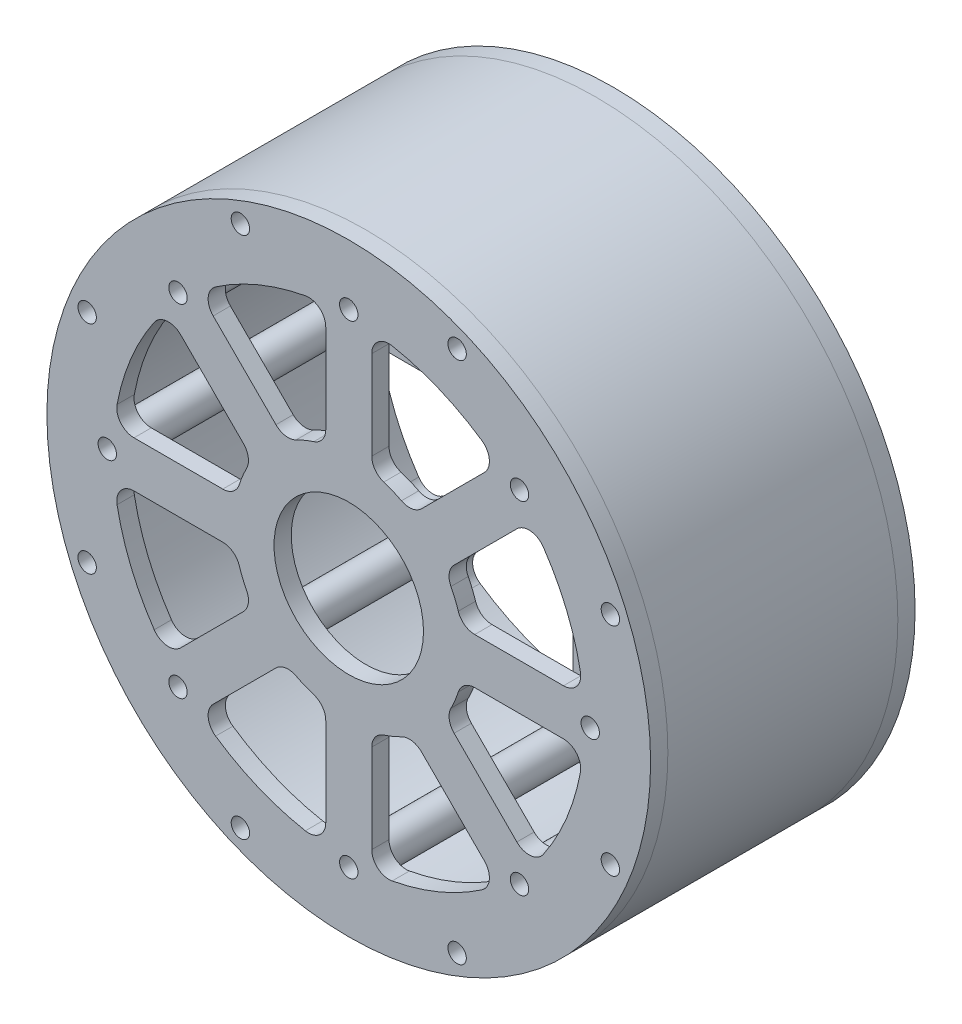
from build123d import *

# Parameters (mm, degrees)
SKETCH_1_R          = 52.5
SKETCH_1_R_2        = 1.6
SKETCH_1_R_3        = 13
EXTRUDE_1_DEPTH     = 3
SKETCH_5_R          = 52.5
SKETCH_5_R_2        = 46
SKETCH_5_R_3        = 1.6
EXTRUDE_3_DEPTH     = 40
SKETCH_2_R          = 3
CUT_EXTRUDE_1_DEPTH = 0.5
SKETCH_3_R          = 3
EXTRUDE_2_DEPTH     = 41
EXTRUDE_2_2_DEPTH   = 41
EXTRUDE_2_3_DEPTH   = 41
EXTRUDE_2_4_DEPTH   = 41
EXTRUDE_2_5_DEPTH   = 41
EXTRUDE_2_6_DEPTH   = 41
EXTRUDE_2_7_DEPTH   = 41
EXTRUDE_2_8_DEPTH   = 41


with BuildPart() as part:
    # ｽｹｯﾁ1 → ﾎﾞｽ - 押し出し1 (new body)
    with BuildSketch(Plane.XY):
        Circle(SKETCH_1_R)
        with Locations((29.69848481, 29.69848481)):
            Circle(SKETCH_1_R_2, mode=Mode.SUBTRACT)
        with Locations((42, 0)):
            Circle(SKETCH_1_R_2, mode=Mode.SUBTRACT)
        with Locations((29.69848481, -29.69848481)):
            Circle(SKETCH_1_R_2, mode=Mode.SUBTRACT)
        with Locations((0, -42)):
            Circle(SKETCH_1_R_2, mode=Mode.SUBTRACT)
        with Locations((-29.69848481, -29.69848481)):
            Circle(SKETCH_1_R_2, mode=Mode.SUBTRACT)
        with Locations((-42, 0)):
            Circle(SKETCH_1_R_2, mode=Mode.SUBTRACT)
        with Locations((-29.69848481, 29.69848481)):
            Circle(SKETCH_1_R_2, mode=Mode.SUBTRACT)
        with Locations((0, 42)):
            Circle(SKETCH_1_R_2, mode=Mode.SUBTRACT)
        with Locations((45.501066976, 18.847159044)):
            Circle(SKETCH_1_R_2, mode=Mode.SUBTRACT)
        with Locations((45.501066976, -18.847159044)):
            Circle(SKETCH_1_R_2, mode=Mode.SUBTRACT)
        with Locations((18.847159044, -45.501066976)):
            Circle(SKETCH_1_R_2, mode=Mode.SUBTRACT)
        with Locations((-18.847159044, -45.501066976)):
            Circle(SKETCH_1_R_2, mode=Mode.SUBTRACT)
        with Locations((-45.501066976, -18.847159044)):
            Circle(SKETCH_1_R_2, mode=Mode.SUBTRACT)
        with Locations((-45.501066976, 18.847159044)):
            Circle(SKETCH_1_R_2, mode=Mode.SUBTRACT)
        with Locations((-18.847159044, 45.501066976)):
            Circle(SKETCH_1_R_2, mode=Mode.SUBTRACT)
        with Locations((18.847159044, 45.501066976)):
            Circle(SKETCH_1_R_2, mode=Mode.SUBTRACT)
        Circle(SKETCH_1_R_3, mode=Mode.SUBTRACT)
        with BuildLine():
            Line((-4, 37.349698794), (-4, 21.9089023))
            ThreePointArc((-4, 21.9089023), (-4.577281441, 20.139598826), (-6.086956522, 19.051219391))
            ThreePointArc((-6.086956522, 19.051219391), (-7.653668647, 18.47759065), (-9.167118188, 17.775374655))
            ThreePointArc((-9.167118188, 17.775374655), (-11.004220154, 17.477473647), (-12.66350626, 18.32036051))
            Line((-12.66350626, 18.32036051), (-23.581798168, 29.238652417))
            ThreePointArc((-23.581798168, 29.238652417), (-24.447615358, 31.637478352), (-23.154726073, 33.835760084))
            ThreePointArc((-23.154726073, 33.835760084), (-15.690020727, 37.879060833), (-7.552631579, 40.298359225))
            ThreePointArc((-7.552631579, 40.298359225), (-5.084000879, 39.658150086), (-4, 37.349698794))
        make_face(mode=Mode.SUBTRACT)
        with BuildLine():
            Line((23.581798168, 29.238652417), (12.66350626, 18.32036051))
            ThreePointArc((12.66350626, 18.32036051), (11.004220154, 17.477473647), (9.167118188, 17.775374655))
            ThreePointArc((9.167118188, 17.775374655), (7.653668647, 18.47759065), (6.086956522, 19.051219391))
            ThreePointArc((6.086956522, 19.051219391), (4.577281441, 20.139598826), (4, 21.9089023))
            Line((4, 21.9089023), (4, 37.349698794))
            ThreePointArc((4, 37.349698794), (5.084000879, 39.658150086), (7.552631579, 40.298359225))
            ThreePointArc((7.552631579, 40.298359225), (15.690020727, 37.879060833), (23.154726073, 33.835760084))
            ThreePointArc((23.154726073, 33.835760084), (24.447615358, 31.637478352), (23.581798168, 29.238652417))
        make_face(mode=Mode.SUBTRACT)
        with BuildLine():
            Line((37.349698794, 4), (21.9089023, 4))
            ThreePointArc((21.9089023, 4), (20.139598826, 4.577281441), (19.051219391, 6.086956522))
            ThreePointArc((19.051219391, 6.086956522), (18.47759065, 7.653668647), (17.775374655, 9.167118188))
            ThreePointArc((17.775374655, 9.167118188), (17.477473647, 11.004220154), (18.32036051, 12.66350626))
            Line((18.32036051, 12.66350626), (29.238652417, 23.581798168))
            ThreePointArc((29.238652417, 23.581798168), (31.637478352, 24.447615358), (33.835760084, 23.154726073))
            ThreePointArc((33.835760084, 23.154726073), (37.879060833, 15.690020727), (40.298359225, 7.552631579))
            ThreePointArc((40.298359225, 7.552631579), (39.658150086, 5.084000879), (37.349698794, 4))
        make_face(mode=Mode.SUBTRACT)
        with BuildLine():
            Line((29.238652417, -23.581798168), (18.32036051, -12.66350626))
            ThreePointArc((18.32036051, -12.66350626), (17.477473647, -11.004220154), (17.775374655, -9.167118188))
            ThreePointArc((17.775374655, -9.167118188), (18.47759065, -7.653668647), (19.051219391, -6.086956522))
            ThreePointArc((19.051219391, -6.086956522), (20.139598826, -4.577281441), (21.9089023, -4))
            Line((21.9089023, -4), (37.349698794, -4))
            ThreePointArc((37.349698794, -4), (39.658150086, -5.084000879), (40.298359225, -7.552631579))
            ThreePointArc((40.298359225, -7.552631579), (37.879060833, -15.690020727), (33.835760084, -23.154726073))
            ThreePointArc((33.835760084, -23.154726073), (31.637478352, -24.447615358), (29.238652417, -23.581798168))
        make_face(mode=Mode.SUBTRACT)
        with BuildLine():
            Line((4, -37.349698794), (4, -21.9089023))
            ThreePointArc((4, -21.9089023), (4.577281441, -20.139598826), (6.086956522, -19.051219391))
            ThreePointArc((6.086956522, -19.051219391), (7.653668647, -18.47759065), (9.167118188, -17.775374655))
            ThreePointArc((9.167118188, -17.775374655), (11.004220154, -17.477473647), (12.66350626, -18.32036051))
            Line((12.66350626, -18.32036051), (23.581798168, -29.238652417))
            ThreePointArc((23.581798168, -29.238652417), (24.447615358, -31.637478352), (23.154726073, -33.835760084))
            ThreePointArc((23.154726073, -33.835760084), (15.690020727, -37.879060833), (7.552631579, -40.298359225))
            ThreePointArc((7.552631579, -40.298359225), (5.084000879, -39.658150086), (4, -37.349698794))
        make_face(mode=Mode.SUBTRACT)
        with BuildLine():
            Line((-23.581798168, -29.238652417), (-12.66350626, -18.32036051))
            ThreePointArc((-12.66350626, -18.32036051), (-11.004220154, -17.477473647), (-9.167118188, -17.775374655))
            ThreePointArc((-9.167118188, -17.775374655), (-7.653668647, -18.47759065), (-6.086956522, -19.051219391))
            ThreePointArc((-6.086956522, -19.051219391), (-4.577281441, -20.139598826), (-4, -21.9089023))
            Line((-4, -21.9089023), (-4, -37.349698794))
            ThreePointArc((-4, -37.349698794), (-5.084000879, -39.658150086), (-7.552631579, -40.298359225))
            ThreePointArc((-7.552631579, -40.298359225), (-15.690020727, -37.879060833), (-23.154726073, -33.835760084))
            ThreePointArc((-23.154726073, -33.835760084), (-24.447615358, -31.637478352), (-23.581798168, -29.238652417))
        make_face(mode=Mode.SUBTRACT)
        with BuildLine():
            Line((-37.349698794, -4), (-21.9089023, -4))
            ThreePointArc((-21.9089023, -4), (-20.139598826, -4.577281441), (-19.051219391, -6.086956522))
            ThreePointArc((-19.051219391, -6.086956522), (-18.47759065, -7.653668647), (-17.775374655, -9.167118188))
            ThreePointArc((-17.775374655, -9.167118188), (-17.477473647, -11.004220154), (-18.32036051, -12.66350626))
            Line((-18.32036051, -12.66350626), (-29.238652417, -23.581798168))
            ThreePointArc((-29.238652417, -23.581798168), (-31.637478352, -24.447615358), (-33.835760084, -23.154726073))
            ThreePointArc((-33.835760084, -23.154726073), (-37.879060833, -15.690020727), (-40.298359225, -7.552631579))
            ThreePointArc((-40.298359225, -7.552631579), (-39.658150086, -5.084000879), (-37.349698794, -4))
        make_face(mode=Mode.SUBTRACT)
        with BuildLine():
            Line((-29.238652417, 23.581798168), (-18.32036051, 12.66350626))
            ThreePointArc((-18.32036051, 12.66350626), (-17.477473647, 11.004220154), (-17.775374655, 9.167118188))
            ThreePointArc((-17.775374655, 9.167118188), (-18.47759065, 7.653668647), (-19.051219391, 6.086956522))
            ThreePointArc((-19.051219391, 6.086956522), (-20.139598826, 4.577281441), (-21.9089023, 4))
            Line((-21.9089023, 4), (-37.349698794, 4))
            ThreePointArc((-37.349698794, 4), (-39.658150086, 5.084000879), (-40.298359225, 7.552631579))
            ThreePointArc((-40.298359225, 7.552631579), (-37.879060833, 15.690020727), (-33.835760084, 23.154726073))
            ThreePointArc((-33.835760084, 23.154726073), (-31.637478352, 24.447615358), (-29.238652417, 23.581798168))
        make_face(mode=Mode.SUBTRACT)
    extrude(amount=EXTRUDE_1_DEPTH)

    # ｽｹｯﾁ2 → ｶｯﾄ - 押し出し1 (cut)
    with BuildSketch(Plane.XY.offset(3)):
        with Locations((0, 42)):
            Circle(SKETCH_2_R)
        with Locations((29.69848481, 29.69848481)):
            Circle(SKETCH_2_R)
        with Locations((42, 0)):
            Circle(SKETCH_2_R)
        with Locations((29.69848481, -29.69848481)):
            Circle(SKETCH_2_R)
        with Locations((0, -42)):
            Circle(SKETCH_2_R)
        with Locations((-29.69848481, -29.69848481)):
            Circle(SKETCH_2_R)
        with Locations((-42, 0)):
            Circle(SKETCH_2_R)
        with Locations((-29.69848481, 29.69848481)):
            Circle(SKETCH_2_R)
    extrude(amount=-CUT_EXTRUDE_1_DEPTH, mode=Mode.SUBTRACT)


with BuildPart() as body_2:
    # ｽｹｯﾁ5 → ﾎﾞｽ - 押し出し3 (new body)
    with BuildSketch(Plane.XY.offset(3)):
        Circle(SKETCH_5_R)
        Circle(SKETCH_5_R_2, mode=Mode.SUBTRACT)
        with Locations((-45.501066976, 18.847159044)):
            Circle(SKETCH_5_R_3, mode=Mode.SUBTRACT)
        with Locations((-45.501066976, -18.847159044)):
            Circle(SKETCH_5_R_3, mode=Mode.SUBTRACT)
        with Locations((-18.847159044, -45.501066976)):
            Circle(SKETCH_5_R_3, mode=Mode.SUBTRACT)
        with Locations((18.847159044, -45.501066976)):
            Circle(SKETCH_5_R_3, mode=Mode.SUBTRACT)
        with Locations((45.501066976, -18.847159044)):
            Circle(SKETCH_5_R_3, mode=Mode.SUBTRACT)
        with Locations((45.501066976, 18.847159044)):
            Circle(SKETCH_5_R_3, mode=Mode.SUBTRACT)
        with Locations((18.847159044, 45.501066976)):
            Circle(SKETCH_5_R_3, mode=Mode.SUBTRACT)
        with Locations((-18.847159044, 45.501066976)):
            Circle(SKETCH_5_R_3, mode=Mode.SUBTRACT)
    extrude(amount=EXTRUDE_3_DEPTH)


with BuildPart() as body_3:
    # ﾐﾗｰ1: mirrored copy
    add(part.part.mirror(Plane.XY.offset(23)))


with BuildPart() as body_4:
    # ｽｹｯﾁ3 → ﾎﾞｽ - 押し出し2 (new body)
    with BuildSketch(Plane.XY.offset(2.5)):
        with Locations(Location((29.69848481, 29.69848481, 0), (0, 0, 180))):
            Circle(SKETCH_3_R)
    extrude(amount=EXTRUDE_2_DEPTH)


with BuildPart() as body_5:
    # ｽｹｯﾁ3 → Extrude 2 2 (new body)
    with BuildSketch(Plane.XY.offset(2.5)):
        with Locations(Location((42, 0, 0), (0, 0, 180))):
            Circle(SKETCH_3_R)
    extrude(amount=EXTRUDE_2_2_DEPTH)


with BuildPart() as body_6:
    # ｽｹｯﾁ3 → Extrude 2 3 (new body)
    with BuildSketch(Plane.XY.offset(2.5)):
        with Locations(Location((29.69848481, -29.69848481, 0), (0, 0, 180))):
            Circle(SKETCH_3_R)
    extrude(amount=EXTRUDE_2_3_DEPTH)


with BuildPart() as body_7:
    # ｽｹｯﾁ3 → Extrude 2 4 (new body)
    with BuildSketch(Plane.XY.offset(2.5)):
        with Locations(Location((0, -42, 0), (0, 0, 180))):
            Circle(SKETCH_3_R)
    extrude(amount=EXTRUDE_2_4_DEPTH)


with BuildPart() as body_8:
    # ｽｹｯﾁ3 → Extrude 2 5 (new body)
    with BuildSketch(Plane.XY.offset(2.5)):
        with Locations(Location((-29.69848481, -29.69848481, 0), (0, 0, 180))):
            Circle(SKETCH_3_R)
    extrude(amount=EXTRUDE_2_5_DEPTH)


with BuildPart() as body_9:
    # ｽｹｯﾁ3 → Extrude 2 6 (new body)
    with BuildSketch(Plane.XY.offset(2.5)):
        with Locations(Location((0, 42, 0), (0, 0, 180))):
            Circle(SKETCH_3_R)
    extrude(amount=EXTRUDE_2_6_DEPTH)


with BuildPart() as body_10:
    # ｽｹｯﾁ3 → Extrude 2 7 (new body)
    with BuildSketch(Plane.XY.offset(2.5)):
        with Locations(Location((-42, 0, 0), (0, 0, 180))):
            Circle(SKETCH_3_R)
    extrude(amount=EXTRUDE_2_7_DEPTH)


with BuildPart() as body_11:
    # ｽｹｯﾁ3 → Extrude 2 8 (new body)
    with BuildSketch(Plane.XY.offset(2.5)):
        with Locations(Location((-29.69848481, 29.69848481, 0), (0, 0, 180))):
            Circle(SKETCH_3_R)
    extrude(amount=EXTRUDE_2_8_DEPTH)


solid = Compound([part.part, body_2.part, body_3.part, body_4.part, body_5.part, body_6.part, body_7.part, body_8.part, body_9.part, body_10.part, body_11.part])
